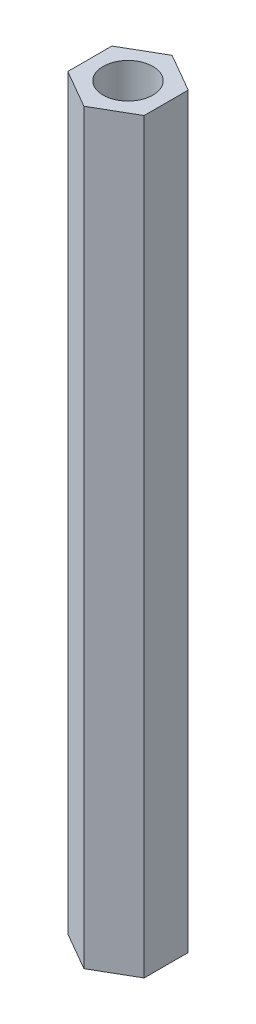
from build123d import *

# Parameters (mm, degrees)
SKETCH_1_R      = 1.5
EXTRUDE_1_DEPTH = 45


with BuildPart() as part:
    # 草图1 → 凸台-拉伸1 (new body)
    with BuildSketch(Plane(origin=(0, 0, 0), x_dir=(1, 0, 0), z_dir=(0, 1, 0))):
        Polygon((0, 2.655811238), (-2.3, 1.327905619), (-2.3, -1.327905619), (0, -2.655811238), (2.3, -1.327905619), (2.3, 1.327905619), align=None)
        with Locations(Location((0, 0, 0), (0, 0, 90))):
            Circle(SKETCH_1_R, mode=Mode.SUBTRACT)
    extrude(amount=EXTRUDE_1_DEPTH)


solid = part.part
